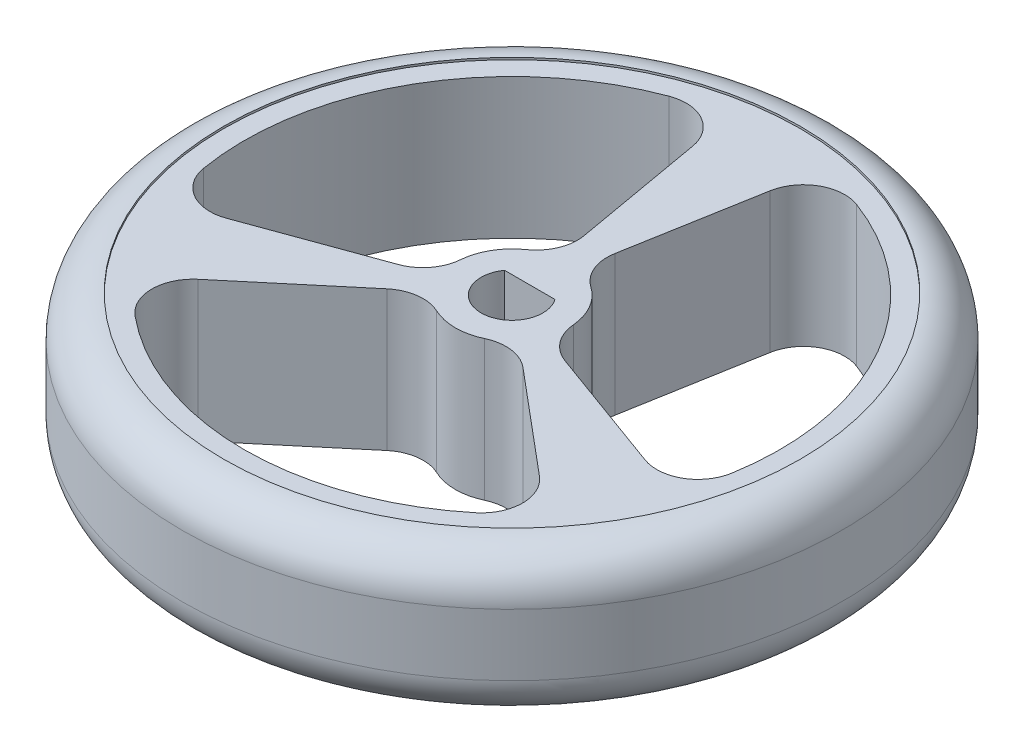
from build123d import *

# Parameters (mm, degrees)
SKETCH1_R           = 16
SKETCH1_R_2         = 13
SKETCH1_R_3         = 2.75
BOSS_EXTRUDE1_DEPTH = 3.5
FILLET2_R           = 2
FILLET3_R           = 2
SKETCH4_R           = 14
CUT_EXTRUDE2_DEPTH  = 0.1


with BuildPart() as part:
    # Sketch1 → Boss-Extrude1 (new, symmetric)
    # profile 1 of 5: a face of its own
    with BuildSketch(Plane(origin=(0, 0, 0), x_dir=(1, 0, 0), z_dir=(0, 1, 0))):
        with Locations(Location((0, 0, 0), (0, 0, 270))):
            Circle(SKETCH1_R)
        Circle(SKETCH1_R_2, mode=Mode.SUBTRACT)
    # profile 2 of 5: a face of its own
    with BuildSketch(Plane(origin=(0, 0, 0), x_dir=(1, 0, 0), z_dir=(0, 1, 0))):
        with BuildLine():
            ThreePointArc((-2.106622219, -1.767665927), (-2.38156986, -1.375), (-2.584154707, -0.940555394))
            Line((-2.584154707, -0.940555394), (-12.21600407, -4.446261863))
            ThreePointArc((-12.21600407, -4.446261863), (-11.258330249, -6.5), (-9.958577761, -8.356238926))
            Line((-9.958577761, -8.356238926), (-2.106622219, -1.767665927))
        make_face()
    # profile 3 of 5: a face of its own
    with BuildSketch(Plane(origin=(0, 0, 0), x_dir=(1, 0, 0), z_dir=(0, 1, 0))):
        Circle(SKETCH1_R_3)
        with BuildLine():
            ThreePointArc((-1.227230113, 0.8625), (0, -1.5), (1.227230113, 0.8625))
            Line((1.227230113, 0.8625), (-1.227230113, 0.8625))
        make_face(mode=Mode.SUBTRACT)
    # profile 4 of 5: a face of its own
    with BuildSketch(Plane(origin=(0, 0, 0), x_dir=(1, 0, 0), z_dir=(0, 1, 0))):
        with BuildLine():
            Line((-2.25742631, 12.802500789), (-0.477532489, 2.708221321))
            ThreePointArc((-0.477532489, 2.708221321), (0, 2.75), (0.477532489, 2.708221321))
            Line((0.477532489, 2.708221321), (2.25742631, 12.802500789))
            ThreePointArc((2.25742631, 12.802500789), (0, 13), (-2.25742631, 12.802500789))
        make_face()
    # profile 5 of 5: a face of its own
    with BuildSketch(Plane(origin=(0, 0, 0), x_dir=(1, 0, 0), z_dir=(0, 1, 0))):
        with BuildLine():
            Line((12.21600407, -4.446261863), (2.584154707, -0.940555394))
            ThreePointArc((2.584154707, -0.940555394), (2.38156986, -1.375), (2.106622219, -1.767665927))
            Line((2.106622219, -1.767665927), (9.958577761, -8.356238926))
            ThreePointArc((9.958577761, -8.356238926), (11.258330249, -6.5), (12.21600407, -4.446261863))
        make_face()
    extrude(amount=BOSS_EXTRUDE1_DEPTH, both=True)

    # Fillet2
    fillet2_edges = [part.edges().sort_by_distance(p)[0] for p in [
        (0, -3.5, -16),
        (0, 3.5, -16),
    ]]
    fillet(fillet2_edges, radius=FILLET2_R)

    # Fillet3
    fillet3_edges = [part.edges().sort_by_distance(p)[0] for p in [
        (2.584154707, 0, 0.940555394),
        (12.21600407, 0, 4.446261863),
        (2.25742631, 0, -12.802500789),
        (0.477532489, 0, -2.708221321),
        (-2.25742631, 0, -12.802500789),
        (-12.21600407, 0, 4.446261863),
        (-2.584154707, 0, 0.940555394),
        (-0.477532489, 0, -2.708221321),
        (-9.958577761, 0, 8.356238926),
        (9.958577761, 0, 8.356238926),
        (2.106622219, 0, 1.767665927),
        (-2.106622219, 0, 1.767665927),
    ]]
    fillet(fillet3_edges, radius=FILLET3_R)

    # Sketch4 → Cut-Extrude2 (cut)
    with BuildSketch(Plane(origin=(0, 3.5, 0), x_dir=(1, 0, 0), z_dir=(0, 1, 0))):
        with Locations(Location((0, 0, 0), (0, 0, 270))):
            Circle(SKETCH4_R)
    cut_extrude2 = extrude(amount=-CUT_EXTRUDE2_DEPTH, mode=Mode.SUBTRACT)

    # Mirror1: Cut-Extrude2 across plane
    add(cut_extrude2.mirror(Plane.ZX), mode=Mode.SUBTRACT)


solid = part.part
